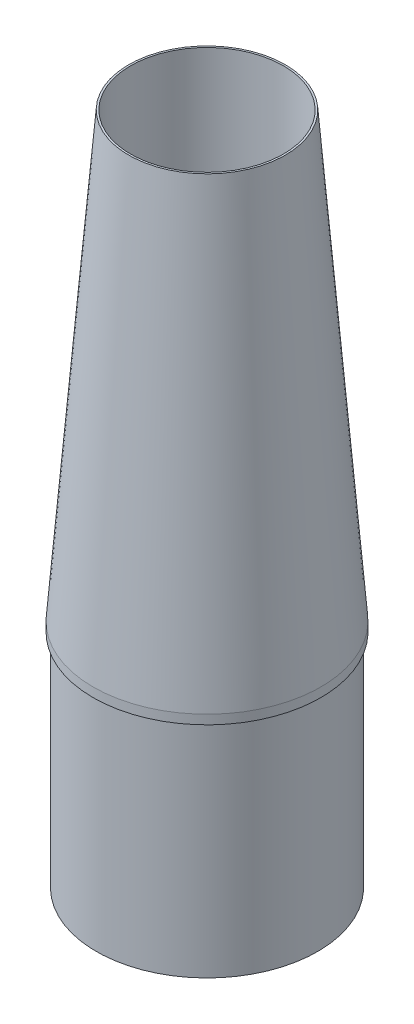
from build123d import *


with BuildPart() as part:
    # Sketch1 → Revolve1 (revolve)
    with BuildSketch(Plane.XY, mode=Mode.PRIVATE) as revolve1_sk:
        Polygon((0, 0), (-34.925, 0), (-34.925, 30.48), (-52.6542, 30.48), (-52.6542, 157.473649841), (-53.9242, 157.473649841), (-78.359, -147.326350159), (-78.359, -153.676350159), (-76.2, -153.676350159), (-76.2, -306.076350159), (-69.85, -306.076350159), (-69.85, -136.541898906), (-61.520886513, -32.644433369), (-38.1, -12.7), (0, -12.7), align=None)
    revolve(revolve1_sk.sketch.rotate(Axis((0, -337.711006289, 0), (0, 1, 0)), 270), axis=Axis((0, -337.711006289, 0), (0, 1, 0)))


solid = part.part
